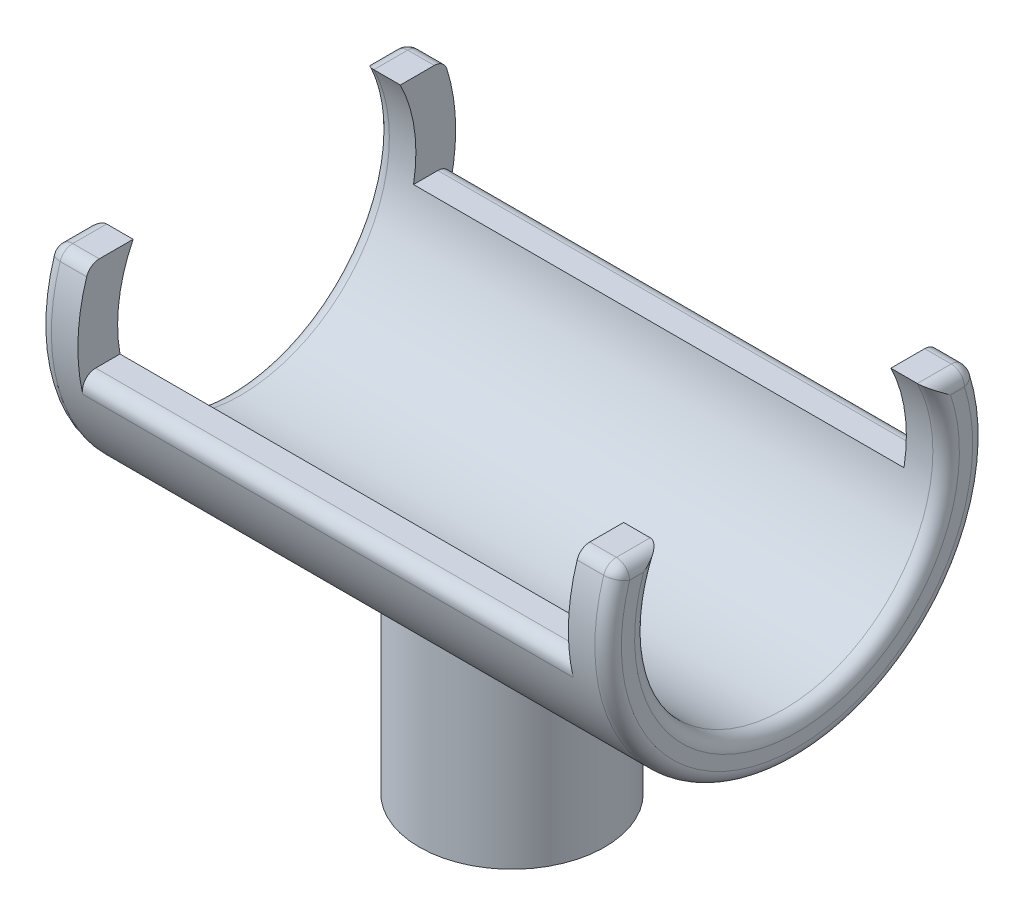
from build123d import *

# Parameters (mm, degrees)
SKETCH1_R           = 7
BOSS_EXTRUDE1_DEPTH = 15
BOSS_EXTRUDE2_DEPTH = 20
BOSS_EXTRUDE3_DEPTH = 1.5
FILLET1_R           = 1


with BuildPart() as part:
    # Sketch1 → Boss-Extrude1 (new body)
    with BuildSketch(Plane(origin=(0, 0, 0), x_dir=(1, 0, 0), z_dir=(0, 1, 0))):
        with Locations(Location((0, 0, 0), (0, 0, 270))):
            Circle(SKETCH1_R)
        with BuildLine():
            Line((-2.598076211, -1.5), (2.598076211, -1.5))
            ThreePointArc((2.598076211, -1.5), (0, 3), (-2.598076211, -1.5))
        make_face(mode=Mode.SUBTRACT)
    extrude(amount=BOSS_EXTRUDE1_DEPTH)


with BuildPart() as body_2:
    # Sketch2 → Boss-Extrude2 (new, symmetric)
    with BuildSketch(Plane(origin=(0, 0, 0), x_dir=(0, 0, -1), z_dir=(1, 0, 0))):
        with BuildLine():
            Line((-14.10895106, 25), (-11.070794913, 25))
            ThreePointArc((-11.070794913, 25), (0, 15.75), (11.070794913, 25))
            Line((11.070794913, 25), (14.10895106, 25))
            ThreePointArc((14.10895106, 25), (0, 12.75), (-14.10895106, 25))
        make_face()
    extrude(amount=BOSS_EXTRUDE2_DEPTH, both=True)

    # Sketch3 → Boss-Extrude3 (add, symmetric)
    with BuildSketch(Plane(origin=(20, 0, 0), x_dir=(0, 0, -1), z_dir=(1, 0, 0))):
        with BuildLine():
            Line((-13.344006145, 32), (-10.077822185, 32))
            ThreePointArc((-10.077822185, 32), (0, 15.75), (10.077822185, 32))
            Line((10.077822185, 32), (13.344006145, 32))
            ThreePointArc((13.344006145, 32), (0, 12.75), (-13.344006145, 32))
        make_face()
    boss_extrude3 = extrude(amount=BOSS_EXTRUDE3_DEPTH, both=True)

    # Mirror1: Boss-Extrude3 across plane
    add(boss_extrude3.mirror(Plane(origin=(0, 0, 0), x_dir=(0, 0, 1), z_dir=(1, 0, 0))))

    # Fillet1
    fillet1_edges = [body_2.edges().sort_by_distance(p)[0] for p in [
        (0, 25, -14.10895106),
        (0, 25, 14.10895106),
        (20, 32, 13.344006145),
        (20, 32, -13.344006145),
        (21.5, 15.75, 0),
        (21.5, 32, 11.710914165),
        (21.5, 12.75, 0),
        (21.5, 32, -11.710914165),
        (-21.5, 15.75, 0),
        (-21.5, 12.75, 0),
        (-20, 32, -13.344006145),
        (-21.5, 32, -11.710914165),
        (-21.5, 32, 11.710914165),
        (-20, 32, 13.344006145),
    ]]
    fillet(fillet1_edges, radius=FILLET1_R)


solid = Compound([part.part, body_2.part])
